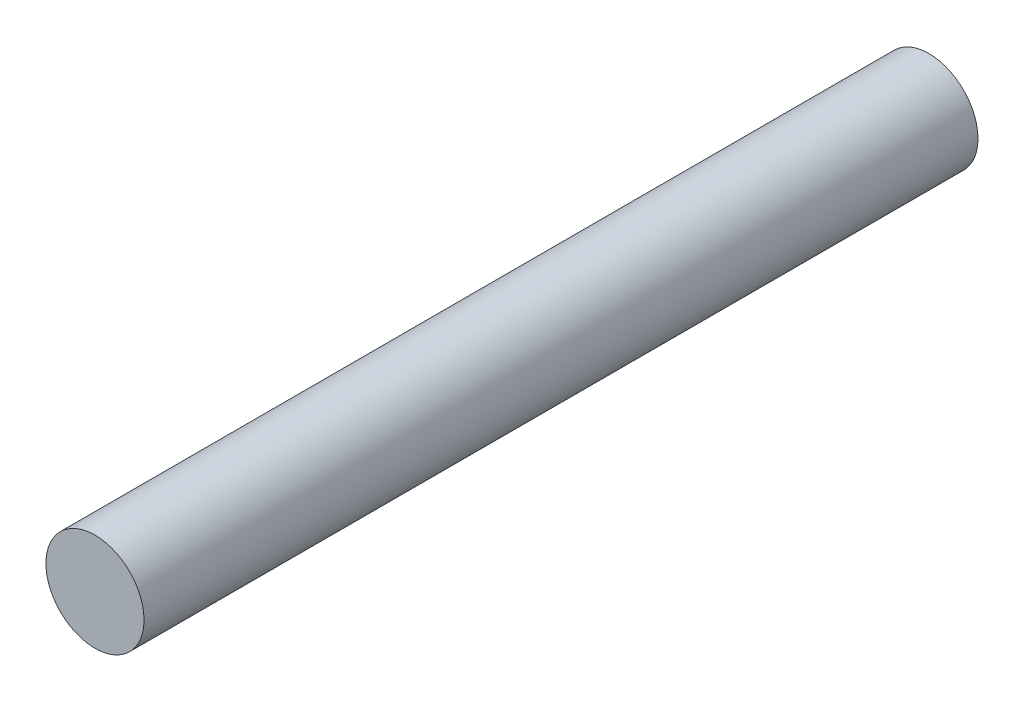
from build123d import *

# Parameters (mm, degrees)
SCHIZZO1_R                   = 2
ESTRUSIONE_ESTRUSIONE1_DEPTH = 34


with BuildPart() as part:
    # Schizzo1 → Estrusione-Estrusione1 (new body)
    with BuildSketch(Plane.XY):
        Circle(SCHIZZO1_R)
    extrude(amount=ESTRUSIONE_ESTRUSIONE1_DEPTH)


solid = part.part
